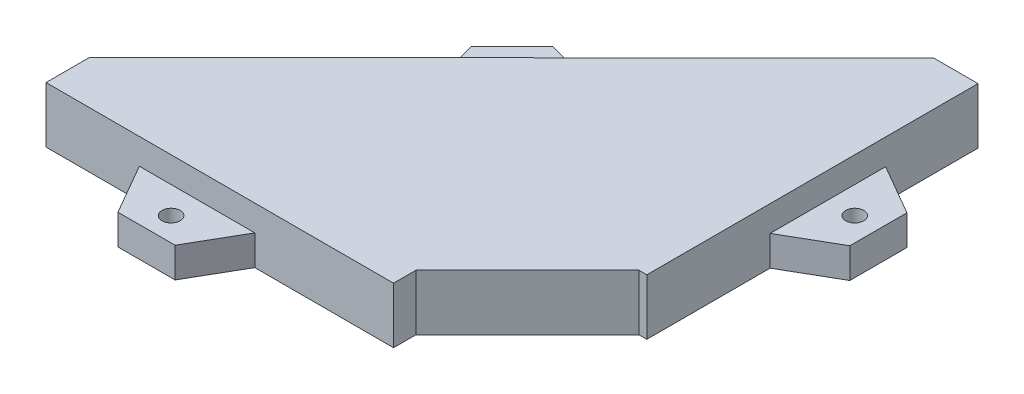
from build123d import *

# Parameters (mm, degrees)
BOSS_EXTRUDE1_DEPTH = 13
BOSS_EXTRUDE2_DEPTH = 7
SKETCH3_R           = 2.1
CUT_EXTRUDE1_DEPTH  = 293.087257838
CUT_EXTRUDE2_DEPTH  = 3.5


with BuildPart() as part:
    # Sketch1 → Boss-Extrude1 (new body)
    with BuildSketch(Plane(origin=(0, -14.270631866, 0), x_dir=(-1, 0, 0), z_dir=(0, -1, 0))):
        Polygon((-95.804533303, -147.092026732), (2.510114699, -245.053270909), (2.510114699, -255.216605782), (-78.283971389, -255.216605782), (-78.283971389, -249.988254121), (-104.187777311, -224.084448198), (-106.041330702, -224.084448198), (-106.041330702, -147.092026732), align=None)
    extrude(amount=-BOSS_EXTRUDE1_DEPTH)

    # Sketch2 → Boss-Extrude2 (add)
    with BuildSketch(Plane.XZ.offset(14.270631866)):
        Polygon((37.243094616, 205.795877803), (-2.510114699, 245.406189427), (-2.510114699, 254.966605782), (19.041650219, 254.966605782), (25.96985345, 266.966605782), (39.248909641, 266.966605782), (46.177112871, 254.966605782), (78.033971389, 254.966605782), (78.033971389, 249.88470073), (104.084223921, 223.834448198), (105.791330702, 223.834448198), (105.791330702, 195.567357996), (117.791330702, 188.639154765), (117.791330702, 175.360098574), (105.791330702, 168.431895344), (105.791330702, 147.092026732), (96.158725005, 147.092026732), (56.444502381, 186.663491807), (43.053372765, 183.04954817), (33.664085816, 192.438835119), align=None)
    extrude(amount=-BOSS_EXTRUDE2_DEPTH)

    # Sketch3 → Cut-Extrude1 (cut, through all)
    with BuildSketch(Plane.XZ.offset(14.270631866)):
        with Locations(Location((42.248028453, 191.633067075, 0), (0, 0, 270))):
            Circle(SKETCH3_R)
        with Locations(Location((32.824351589, 261.466605782, 0), (0, 0, 270))):
            Circle(SKETCH3_R)
        with Locations(Location((112.291330702, 181.99962667, 0), (0, 0, 270))):
            Circle(SKETCH3_R)
    extrude(amount=-CUT_EXTRUDE1_DEPTH, mode=Mode.SUBTRACT)

    # Sketch4 → Cut-Extrude2 (cut)
    with BuildSketch(Plane.XZ.offset(14.270631866)):
        Polygon((36.865803473, 261.466605782), (34.845077531, 264.966605782), (30.803625647, 264.966605782), (28.782899705, 261.466605782), (30.803625647, 257.966605782), (34.845077531, 257.966605782), align=None)
        Polygon((46.151771204, 192.679071793), (43.29403317, 195.536809826), (39.39029042, 194.490805109), (38.344285702, 190.587062358), (41.202023735, 187.729324324), (45.105766486, 188.775329042), align=None)
        Polygon((108.791330702, 184.020352612), (108.791330702, 179.978900727), (112.291330702, 177.958174785), (115.791330702, 179.978900727), (115.791330702, 184.020352612), (112.291330702, 186.041078554), align=None)
    extrude(amount=-CUT_EXTRUDE2_DEPTH, mode=Mode.SUBTRACT)


solid = part.part
